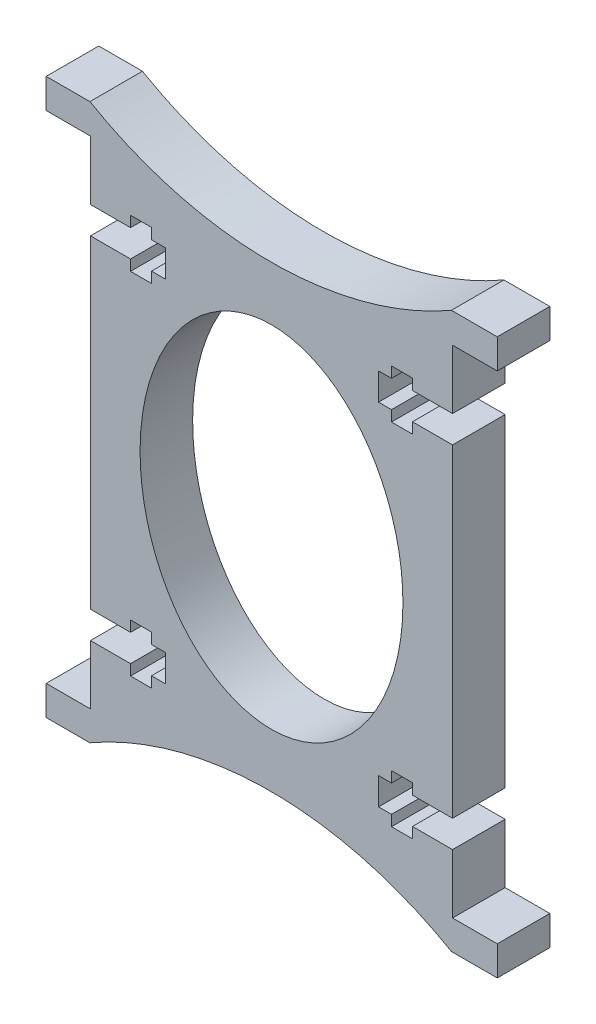
from build123d import *

# Parameters (mm, degrees)
SKETCH1_RX          = 20
SKETCH1_RY          = 15
BOSS_EXTRUDE1_DEPTH = 6


with BuildPart() as part:
    # Sketch1 → Boss-Extrude1 (new body)
    with BuildSketch(Plane.XY):
        with BuildLine():
            Line((735.278050496, 436.653824982), (737.672420097, 436.653824982))
            Line((737.672420097, 436.653824982), (737.672420097, 437.878226994))
            Line((737.672420097, 437.878226994), (742.24679609, 437.878226994))
            Line((742.24679609, 437.878226994), (742.24679609, 431.116067))
            Line((742.24679609, 431.116067), (747.348599543, 431.116067))
            Line((747.348599543, 431.116067), (747.348599543, 427.736067))
            Line((747.348599543, 427.736067), (742.114877809, 427.736067))
            ThreePointArc((742.114877809, 427.736067), (721.48448246, 433.262998961), (700.85408711, 427.736067))
            Line((700.85408711, 427.736067), (695.865635692, 427.736067))
            Line((695.865635692, 427.736067), (695.865635692, 431.116067))
            Line((695.865635692, 431.116067), (700.917916144, 431.116067))
            Line((700.917916144, 431.116067), (700.917916144, 437.878226994))
            Line((700.917916144, 437.878226994), (705.492292137, 437.878226994))
            Line((705.492292137, 437.878226994), (705.492292137, 436.653824982))
            Line((705.492292137, 436.653824982), (707.886661739, 436.653824982))
            Line((707.886661739, 436.653824982), (707.886661739, 437.878226994))
            Line((707.886661739, 437.878226994), (709.486661739, 437.878226994))
            Line((709.486661739, 437.878226994), (709.486661739, 440.973907006))
            Line((709.486661739, 440.973907006), (707.886661739, 440.973907006))
            Line((707.886661739, 440.973907006), (707.886661739, 442.198309018))
            Line((707.886661739, 442.198309018), (705.492292137, 442.198309018))
            Line((705.492292137, 442.198309018), (705.492292137, 440.973907006))
            Line((705.492292137, 440.973907006), (700.917916144, 440.973907006))
            Line((700.917916144, 440.973907006), (700.917916144, 459.426067))
            Line((700.917916144, 459.426067), (700.917916144, 477.878226994))
            Line((700.917916144, 477.878226994), (705.492292137, 477.878226994))
            Line((705.492292137, 477.878226994), (705.492292137, 476.653824982))
            Line((705.492292137, 476.653824982), (707.886661739, 476.653824982))
            Line((707.886661739, 476.653824982), (707.886661739, 477.878226994))
            Line((707.886661739, 477.878226994), (709.486661739, 477.878226994))
            Line((709.486661739, 477.878226994), (709.486661739, 480.973907006))
            Line((709.486661739, 480.973907006), (707.886661739, 480.973907006))
            Line((707.886661739, 480.973907006), (707.886661739, 482.198309018))
            Line((707.886661739, 482.198309018), (705.492292137, 482.198309018))
            Line((705.492292137, 482.198309018), (705.492292137, 480.973907006))
            Line((705.492292137, 480.973907006), (700.917916144, 480.973907006))
            Line((700.917916144, 480.973907006), (700.917916144, 487.736067))
            Line((700.917916144, 487.736067), (695.865635692, 487.736067))
            Line((695.865635692, 487.736067), (695.865635692, 491.116067))
            Line((695.865635692, 491.116067), (700.85408711, 491.116067))
            ThreePointArc((700.85408711, 491.116067), (721.48448246, 485.589135038), (742.114877809, 491.116067))
            Line((742.114877809, 491.116067), (747.348599543, 491.116067))
            Line((747.348599543, 491.116067), (747.348599543, 487.736067))
            Line((747.348599543, 487.736067), (742.24679609, 487.736067))
            Line((742.24679609, 487.736067), (742.24679609, 480.973907006))
            Line((742.24679609, 480.973907006), (737.672420097, 480.973907006))
            Line((737.672420097, 480.973907006), (737.672420097, 482.198309018))
            Line((737.672420097, 482.198309018), (735.278050496, 482.198309018))
            Line((735.278050496, 482.198309018), (735.278050496, 480.973907006))
            Line((735.278050496, 480.973907006), (733.799948182, 480.973907006))
            Line((733.799948182, 480.973907006), (733.799948182, 477.878226994))
            Line((733.799948182, 477.878226994), (735.278050496, 477.878226994))
            Line((735.278050496, 477.878226994), (735.278050496, 476.653824982))
            Line((735.278050496, 476.653824982), (737.672420097, 476.653824982))
            Line((737.672420097, 476.653824982), (737.672420097, 477.878226994))
            Line((737.672420097, 477.878226994), (742.24679609, 477.878226994))
            Line((742.24679609, 477.878226994), (742.24679609, 459.426067))
            Line((742.24679609, 459.426067), (742.24679609, 440.973907006))
            Line((742.24679609, 440.973907006), (737.672420097, 440.973907006))
            Line((737.672420097, 440.973907006), (737.672420097, 442.198309018))
            Line((737.672420097, 442.198309018), (735.278050496, 442.198309018))
            Line((735.278050496, 442.198309018), (735.278050496, 440.973907006))
            Line((735.278050496, 440.973907006), (733.799948182, 440.973907006))
            Line((733.799948182, 440.973907006), (733.799948182, 437.878226994))
            Line((733.799948182, 437.878226994), (735.278050496, 437.878226994))
            Line((735.278050496, 437.878226994), (735.278050496, 436.653824982))
        make_face()
        with Locations(Location((721.582356117, 459.426067), (0, 0, 90))):
            Ellipse(SKETCH1_RX, SKETCH1_RY, mode=Mode.SUBTRACT)
    extrude(amount=BOSS_EXTRUDE1_DEPTH)


solid = part.part
